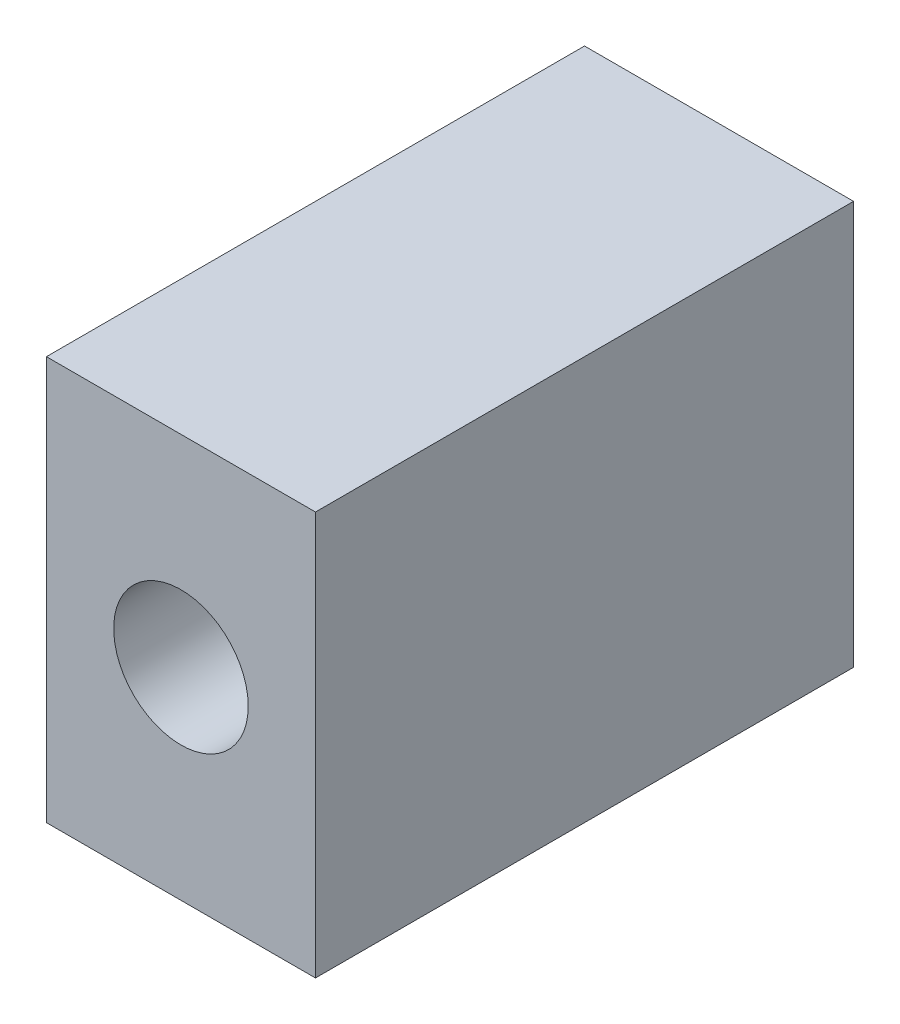
from build123d import *

# Parameters (mm, degrees)
SKETCH_BASE_PROFILE_W      = 20
SKETCH_BASE_PROFILE_H      = 30
FEATURE_BASE_DEPTH         = 40
SKETCH_HOLE_PROFILE_R      = 5
FEATURE_THROUGH_HOLE_DEPTH = 54.851648071


with BuildPart() as part:
    # sketch:base-profile → feature:base (new body)
    with BuildSketch(Plane.XY):
        with Locations((10, 15)):
            Rectangle(SKETCH_BASE_PROFILE_W, SKETCH_BASE_PROFILE_H)
    extrude(amount=FEATURE_BASE_DEPTH)

    # sketch:hole-profile → feature:through-hole (cut, through all)
    with BuildSketch(Plane.XY.offset(40)):
        with Locations((10, 15)):
            Circle(SKETCH_HOLE_PROFILE_R)
    extrude(amount=-FEATURE_THROUGH_HOLE_DEPTH, mode=Mode.SUBTRACT)


solid = part.part
